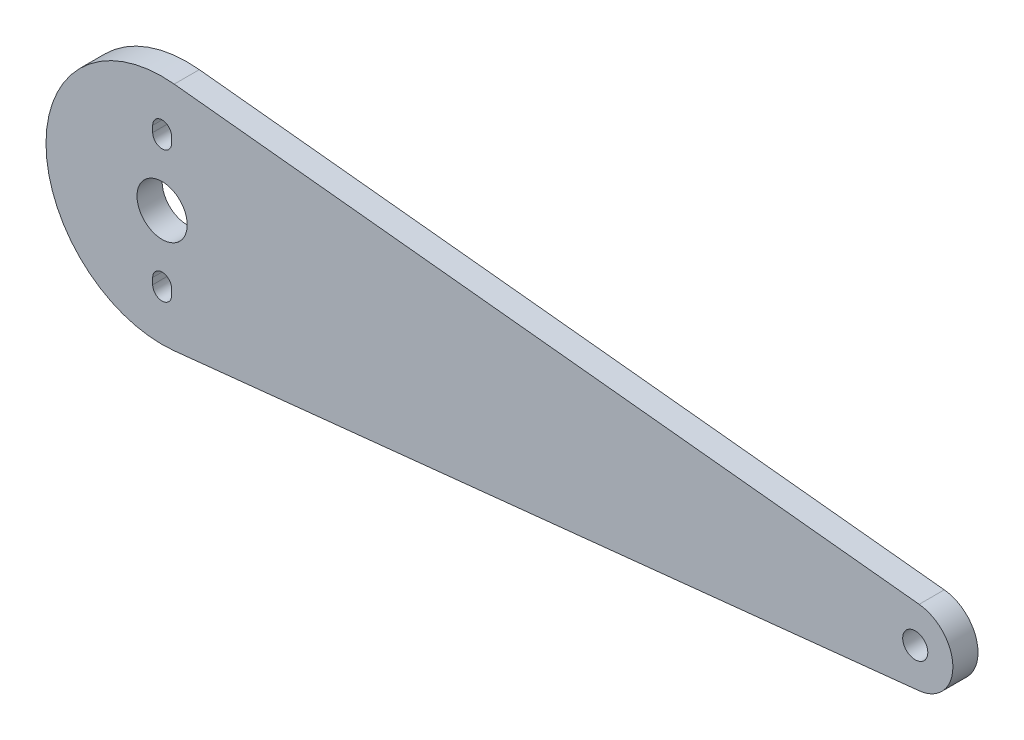
from build123d import *

# Parameters (mm, degrees)
SKETCH1_R           = 2
SKETCH1_R_2         = 4
BOSS_EXTRUDE1_DEPTH = 4


with BuildPart() as part:
    # Sketch1 → Boss-Extrude1 (new body)
    with BuildSketch(Plane.XY):
        with BuildLine():
            Line((-58.072916667, 18.399357321), (60.625, 5.967359131))
            ThreePointArc((60.625, 5.967359131), (66, 0), (60.625, -5.967359131))
            Line((60.625, -5.967359131), (-58.072916667, -18.399357321))
            ThreePointArc((-58.072916667, -18.399357321), (-78.5, 0), (-58.072916667, 18.399357321))
        make_face()
        with Locations((60, 0)):
            Circle(SKETCH1_R, mode=Mode.SUBTRACT)
        with Locations((-60, 0)):
            Circle(SKETCH1_R_2, mode=Mode.SUBTRACT)
        with BuildLine():
            Line((-58.5, 11), (-58.5, 10))
            ThreePointArc((-58.5, 10), (-60, 8.5), (-61.5, 10))
            Line((-61.5, 10), (-61.5, 11))
            ThreePointArc((-61.5, 11), (-60, 12.5), (-58.5, 11))
        make_face(mode=Mode.SUBTRACT)
        with BuildLine():
            Line((-58.5, -11), (-58.5, -10))
            ThreePointArc((-58.5, -10), (-60, -8.5), (-61.5, -10))
            Line((-61.5, -10), (-61.5, -11))
            ThreePointArc((-61.5, -11), (-60, -12.5), (-58.5, -11))
        make_face(mode=Mode.SUBTRACT)
    extrude(amount=BOSS_EXTRUDE1_DEPTH)


solid = part.part
